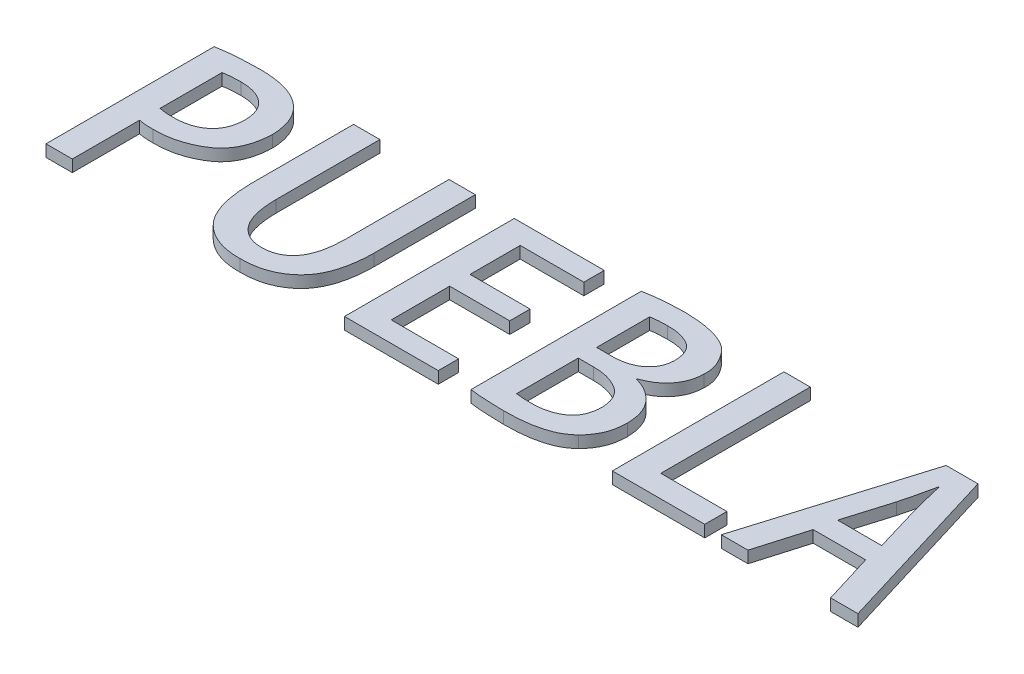
from build123d import *

# Parameters (mm, degrees)
SALIENTE_EXTRUIR1_DEPTH   = 0.3
SALIENTE_EXTRUIR1_2_DEPTH = 0.3
SALIENTE_EXTRUIR1_3_DEPTH = 0.3
SALIENTE_EXTRUIR1_4_DEPTH = 0.3
SALIENTE_EXTRUIR1_5_DEPTH = 0.3
SALIENTE_EXTRUIR1_6_DEPTH = 0.3


with BuildPart() as part:
    # Croquis1 → Saliente-Extruir1 (new body)
    with BuildSketch(Plane(origin=(0, 0, 0), x_dir=(1, 0, 0), z_dir=(0, 1, 0))):
        with BuildLine():
            Line((-10.215103216, -3.577941282), (-9.548221633, -3.577941282))
            Line((-9.548221633, -3.577941282), (-9.548221633, -1.875213278))
            add(Edge.make_bspline(
                [(-9.548221633, -1.875213278), (-9.520350913, -1.88015728), (-9.462938021, -1.890341783), (-9.373435224, -1.898640382), (-9.278633093, -1.903839455), (-9.213694309, -1.903745706), (-9.180287408, -1.903697479)],
                knots=[0, 0, 0, 0, 0.918571729, 1.892231672, 2.915686383, 4, 4, 4, 4], degree=3))
            add(Edge.make_bspline(
                [(-9.180287408, -1.903697479), (-9.129611086, -1.9036698), (-9.02944017, -1.903615088), (-8.881261609, -1.889723662), (-8.736809014, -1.867048802), (-8.596152434, -1.833407476), (-8.459358645, -1.788596242), (-8.326131654, -1.734489279), (-8.196758559, -1.670109055), (-8.072010865, -1.596305731), (-7.955554322, -1.509944508), (-7.852528436, -1.407990924), (-7.765248608, -1.291123391), (-7.692289474, -1.160444791), (-7.634194871, -1.016060674), (-7.590810943, -0.85763014), (-7.561903091, -0.685334874), (-7.555166904, -0.56539569), (-7.551685697, -0.503412094)],
                knots=[0, 0, 0, 0, 1.002223409, 1.981075816, 2.941057117, 3.893567037, 4.839120738, 5.786658294, 6.736252809, 7.695867274, 8.651375827, 9.597441389, 10.552949943, 11.527852714, 12.550822771, 13.624507394, 14.772364707, 16, 16, 16, 16], degree=3))
            add(Edge.make_bspline(
                [(-7.551685697, -0.503412094), (-7.553820832, -0.454883355), (-7.557988998, -0.360146555), (-7.578764184, -0.22263141), (-7.610733835, -0.093588342), (-7.654112582, 0.027315295), (-7.710313298, 0.139206348), (-7.777346298, 0.243071187), (-7.856167965, 0.338391658), (-7.917525413, 0.393601624), (-7.948364782, 0.421351157)],
                knots=[0, 0, 0, 0, 1.121960372, 2.190267843, 3.207584746, 4.190239261, 5.152208329, 6.094546313, 7.042284316, 8, 8, 8, 8], degree=3))
            add(Edge.make_bspline(
                [(-7.948364782, 0.421351157), (-7.983047776, 0.449337645), (-8.053504953, 0.506191127), (-8.173465029, 0.576538023), (-8.30520151, 0.636212701), (-8.449185823, 0.685810899), (-8.605979342, 0.723359079), (-8.775297849, 0.748515141), (-8.95681361, 0.765865816), (-9.081963044, 0.767228235), (-9.146614857, 0.767932056)],
                knots=[0, 0, 0, 0, 0.838628006, 1.70364077, 2.610636308, 3.559859354, 4.568055018, 5.643200099, 6.782484425, 8, 8, 8, 8], degree=3))
            add(Edge.make_bspline(
                [(-9.146614857, 0.767932056), (-9.201095723, 0.766953778), (-9.307335336, 0.765046102), (-9.462317186, 0.760318743), (-9.608818019, 0.753046696), (-9.74677935, 0.742957147), (-9.876361541, 0.731889146), (-9.997410579, 0.717902858), (-10.109697528, 0.70167953), (-10.181462099, 0.688734839), (-10.215923696, 0.682518754)],
                knots=[0, 0, 0, 0, 1.217605855, 2.374374404, 3.464660226, 4.494999595, 5.465333604, 6.370582827, 7.217548217, 8, 8, 8, 8], degree=3))
            Line((-10.215923696, 0.682518754), (-10.215103216, -3.577941282))
        make_face()
        with BuildLine():
            add(Edge.make_bspline(
                [(-9.548221633, 0.212546688), (-9.522541986, 0.217605893), (-9.464399067, 0.229060761), (-9.365001308, 0.239581334), (-9.243640978, 0.247627745), (-9.155117711, 0.250039934), (-9.107193333, 0.251345835)],
                knots=[0, 0, 0, 0, 0.7081459, 1.603358068, 2.702515415, 4, 4, 4, 4], degree=3))
            add(Edge.make_bspline(
                [(-9.107193333, 0.251345835), (-9.074597065, 0.250665074), (-9.010919284, 0.249335187), (-8.917805658, 0.240424923), (-8.829715919, 0.22474425), (-8.746508873, 0.203401444), (-8.668134692, 0.176711592), (-8.595132951, 0.142464591), (-8.527060134, 0.102499207), (-8.464384125, 0.056194149), (-8.407083461, 0.004666536), (-8.3577692, -0.054161378), (-8.315308541, -0.118814723), (-8.2809486, -0.189874601), (-8.2537786, -0.266740419), (-8.234165544, -0.349602283), (-8.221744084, -0.438439087), (-8.219644781, -0.499811722), (-8.218566478, -0.531335674)],
                knots=[0, 0, 0, 0, 1.16517395, 2.276202082, 3.339667925, 4.360262278, 5.344409501, 6.294443781, 7.237649562, 8.161467064, 9.075802852, 9.985465996, 10.897442204, 11.83402534, 12.799705885, 13.806079676, 14.873096483, 16, 16, 16, 16], degree=3))
            add(Edge.make_bspline(
                [(-8.218566478, -0.531335674), (-8.219668589, -0.56476907), (-8.22181711, -0.629946143), (-8.233962251, -0.724622728), (-8.25465111, -0.813129388), (-8.282603263, -0.89569976), (-8.317680611, -0.972665381), (-8.361753618, -1.043188549), (-8.413897457, -1.107414623), (-8.473181539, -1.166073002), (-8.539748123, -1.217720806), (-8.613054724, -1.262207725), (-8.691932445, -1.301168873), (-8.777655358, -1.332225993), (-8.869664708, -1.35562452), (-8.967514775, -1.374050666), (-9.07193087, -1.384453841), (-9.143581899, -1.386211064), (-9.180287408, -1.387111258)],
                knots=[0, 0, 0, 0, 1.098810706, 2.142087657, 3.130558938, 4.080710143, 5.002414742, 5.90351999, 6.805477983, 7.715119197, 8.638227497, 9.567016518, 10.528554789, 11.524610674, 12.556657526, 13.645294696, 14.7937276, 16, 16, 16, 16], degree=3))
            add(Edge.make_bspline(
                [(-9.180287408, -1.387111258), (-9.216161545, -1.387234798), (-9.284679018, -1.387470752), (-9.381990202, -1.38162005), (-9.469260651, -1.372005766), (-9.522850395, -1.359404555), (-9.548221633, -1.353438706)],
                knots=[0, 0, 0, 0, 1.161542367, 2.218477041, 3.156565424, 4, 4, 4, 4], degree=3))
            Line((-9.548221633, -1.353438706), (-9.548221633, 0.212546688))
        make_face(mode=Mode.SUBTRACT)
    extrude(amount=SALIENTE_EXTRUIR1_DEPTH)


with BuildPart() as body_2:
    # Croquis1 → Saliente-Extruir1 2 (new body)
    with BuildSketch(Plane(origin=(0, 0, 0), x_dir=(1, 0, 0), z_dir=(0, 1, 0))):
        with BuildLine():
            Line((-3.661274846, 0.744646633), (-4.32815643, 0.744646633))
            Line((-4.32815643, 0.744646633), (-4.32815643, -1.883706807))
            add(Edge.make_bspline(
                [(-4.32815643, -1.883706807), (-4.329655429, -1.935558276), (-4.332559144, -2.035999858), (-4.343561411, -2.181206874), (-4.362274872, -2.315668667), (-4.388295362, -2.439275598), (-4.421736178, -2.552320019), (-4.462608717, -2.654412765), (-4.510511118, -2.745968439), (-4.565435138, -2.826941756), (-4.627854346, -2.897196695), (-4.695244721, -2.958606014), (-4.76880987, -3.00970639), (-4.847946944, -3.05143435), (-4.932772322, -3.083141251), (-5.022992432, -3.106459931), (-5.118932888, -3.119567849), (-5.184712447, -3.120949978), (-5.218424243, -3.121658315)],
                knots=[0, 0, 0, 0, 1.438585386, 2.786686621, 4.036552978, 5.201082612, 6.286862056, 7.302011853, 8.246194207, 9.147550894, 10.00824043, 10.846879081, 11.670430889, 12.485539397, 13.321768657, 14.176240106, 15.065329361, 16, 16, 16, 16], degree=3))
            add(Edge.make_bspline(
                [(-5.218424243, -3.121658315), (-5.249679282, -3.121295871), (-5.310849122, -3.120586526), (-5.400216049, -3.107134353), (-5.484736532, -3.083917267), (-5.564867689, -3.051600867), (-5.640987235, -3.010849071), (-5.711164992, -2.958819618), (-5.777370385, -2.898429369), (-5.839131913, -2.828675921), (-5.894692447, -2.747984077), (-5.942716651, -2.656605797), (-5.984299517, -2.55437008), (-6.016951527, -2.441027624), (-6.044431961, -2.317116595), (-6.063543247, -2.182306163), (-6.076020104, -2.036700568), (-6.078068576, -1.936028404), (-6.079127518, -1.883986717)],
                knots=[0, 0, 0, 0, 0.880620858, 1.723480129, 2.540049658, 3.347149052, 4.155502796, 4.967718036, 5.803797264, 6.678919068, 7.589027408, 8.559476972, 9.584493291, 10.69587747, 11.881568968, 13.161133164, 14.532470029, 16, 16, 16, 16], degree=3))
            Line((-6.079127518, -1.883986717), (-6.079127518, 0.744646633))
            Line((-6.079127518, 0.744646633), (-6.746009102, 0.744646633))
            Line((-6.746009102, 0.744646633), (-6.746009102, -1.843969282))
            add(Edge.make_bspline(
                [(-6.746009102, -1.843969282), (-6.744320163, -1.921423283), (-6.74105939, -2.070960884), (-6.719359671, -2.286539978), (-6.686228752, -2.485366125), (-6.640690087, -2.66742907), (-6.582706007, -2.832726342), (-6.5119174, -2.981076339), (-6.428799591, -3.112975235), (-6.332822765, -3.228019066), (-6.225971478, -3.326755054), (-6.110917482, -3.412244231), (-5.986899263, -3.484091292), (-5.85403463, -3.542344372), (-5.712936211, -3.587901969), (-5.56311633, -3.618577115), (-5.405069403, -3.637331995), (-5.296773969, -3.637935872), (-5.241420132, -3.638244536)],
                knots=[0, 0, 0, 0, 1.38962604, 2.682900096, 3.883708864, 5.003577014, 6.046051179, 7.021519621, 7.946782916, 8.836077995, 9.701502405, 10.551298335, 11.403065278, 12.267387725, 13.149723428, 14.058184006, 15.007465389, 16, 16, 16, 16], degree=3))
            add(Edge.make_bspline(
                [(-5.241420132, -3.638244536), (-5.183600376, -3.637668213), (-5.070636242, -3.636542233), (-4.905757123, -3.616966204), (-4.749475123, -3.585305213), (-4.601955464, -3.539657541), (-4.463713887, -3.478600884), (-4.333236745, -3.406142648), (-4.212889994, -3.31768041), (-4.100008521, -3.217547068), (-3.998275414, -3.101071197), (-3.910116581, -2.967499268), (-3.835334395, -2.817648031), (-3.773804383, -2.651273132), (-3.725873808, -2.468545742), (-3.691237991, -2.26934804), (-3.667616862, -2.05399255), (-3.663977459, -1.904585031), (-3.662095326, -1.827318276)],
                knots=[0, 0, 0, 0, 1.011965347, 1.977106012, 2.902281606, 3.801441794, 4.675206323, 5.544580214, 6.409541179, 7.285433736, 8.18245704, 9.109221175, 10.080450816, 11.108962635, 12.210199246, 13.38382548, 14.647033859, 16, 16, 16, 16], degree=3))
            Line((-3.662095326, -1.827318276), (-3.661274846, 0.744646633))
        make_face()
    extrude(amount=SALIENTE_EXTRUIR1_2_DEPTH)


with BuildPart() as body_3:
    # Croquis1 → Saliente-Extruir1 3 (new body)
    with BuildSketch(Plane(origin=(0, 0, 0), x_dir=(1, 0, 0), z_dir=(0, 1, 0))):
        Polygon((-0.270575443, -3.06868484), (-1.979289019, -3.06868484), (-1.979289019, -1.58791625), (-0.45790949, -1.58791625), (-0.45790949, -1.071328425), (-1.979289019, -1.071328425), (-1.979289019, 0.199192037), (-0.367080861, 0.199192037), (-0.367080861, 0.715779863), (-2.646170603, 0.715779863), (-2.646170603, -3.585272665), (-0.270575443, -3.585272665), align=None)
    extrude(amount=SALIENTE_EXTRUIR1_3_DEPTH)


with BuildPart() as body_4:
    # Croquis1 → Saliente-Extruir1 4 (new body)
    with BuildSketch(Plane(origin=(0, 0, 0), x_dir=(1, 0, 0), z_dir=(0, 1, 0))):
        with BuildLine():
            add(Edge.make_bspline(
                [(2.427912571, -1.249105447), (2.457304513, -1.238302352), (2.51499113, -1.217099466), (2.596974007, -1.178937297), (2.674335394, -1.137753039), (2.74604166, -1.09221914), (2.812449258, -1.042157829), (2.874162796, -0.989170317), (2.930244684, -0.931460251), (2.980136332, -0.869884267), (3.024529145, -0.80542697), (3.06432428, -0.739163923), (3.097196457, -0.67007939), (3.123294998, -0.598671394), (3.145244396, -0.525633836), (3.159512944, -0.44991315), (3.168998425, -0.372246203), (3.170306483, -0.319747514), (3.170968839, -0.293163966)],
                knots=[0, 0, 0, 0, 1.158010079, 2.272789037, 3.3421568, 4.398545089, 5.411311129, 6.416452725, 7.404821061, 8.383909716, 9.344703944, 10.298264987, 11.240518476, 12.169838246, 13.108875005, 14.058285776, 15.016782025, 16, 16, 16, 16], degree=3))
            add(Edge.make_bspline(
                [(3.170968839, -0.293163966), (3.172279888, -0.263033669), (3.174920164, -0.202355281), (3.1648979, -0.111205119), (3.146460736, -0.019799734), (3.115096551, 0.070639332), (3.074763229, 0.16192161), (3.022727489, 0.252587232), (2.960430361, 0.343270192), (2.888837475, 0.43451757), (2.800622897, 0.521834376), (2.6891127, 0.596425571), (2.557141455, 0.659823121), (2.405275975, 0.714129553), (2.232137514, 0.755461388), (2.039154019, 0.789379123), (1.824753378, 0.810806275), (1.674911301, 0.817168057), (1.596571723, 0.820494088)],
                knots=[0, 0, 0, 0, 0.662582201, 1.334351894, 2.01115102, 2.710095991, 3.435323525, 4.2039863, 5.00579069, 5.854169704, 6.752811591, 7.723346771, 8.789937867, 9.967205469, 11.26427748, 12.700938597, 14.275203597, 16, 16, 16, 16], degree=3))
            add(Edge.make_bspline(
                [(1.596571723, 0.820494088), (1.498805662, 0.818967553), (1.307727032, 0.815984021), (1.0730719, 0.799095328), (0.896136507, 0.780236647), (0.774738941, 0.764928746), (0.663624979, 0.746859173), (0.59293774, 0.733314703), (0.559292872, 0.726867968)],
                knots=[0, 0, 0, 0, 1.687173059, 3.297491112, 4.057661749, 4.757936521, 5.408817464, 6, 6, 6, 6], degree=3))
            Line((0.559292872, 0.726867968), (0.560113352, -3.585595885))
            add(Edge.make_bspline(
                [(0.560113352, -3.585595885), (0.585547474, -3.589391121), (0.639571911, -3.597452556), (0.725952737, -3.605797876), (0.821729996, -3.61439701), (0.927225423, -3.620228237), (1.042143949, -3.62747002), (1.166755119, -3.631799366), (1.300610405, -3.636310643), (1.392889841, -3.637586096), (1.440528191, -3.638244536)],
                knots=[0, 0, 0, 0, 0.699185398, 1.485134748, 2.359315875, 3.314070099, 4.357999124, 5.490443077, 6.704465959, 8, 8, 8, 8], degree=3))
            add(Edge.make_bspline(
                [(1.440528191, -3.638244536), (1.48378965, -3.63831731), (1.568701305, -3.638460148), (1.693539879, -3.632776324), (1.813576544, -3.626130181), (1.928598488, -3.614407868), (2.038367936, -3.599511745), (2.143461599, -3.58267672), (2.243151078, -3.561264895), (2.33801951, -3.536750366), (2.427435692, -3.508503313), (2.512380306, -3.478870083), (2.591546737, -3.44368605), (2.666137843, -3.406403724), (2.735789358, -3.36523265), (2.799466933, -3.319766174), (2.859339319, -3.272430309), (2.895295218, -3.237497197), (2.913086369, -3.220212125)],
                knots=[0, 0, 0, 0, 1.322760237, 2.59625459, 3.820847638, 4.998735831, 6.130623795, 7.208270984, 8.252558636, 9.247527692, 10.203409462, 11.119645776, 11.996881918, 12.850511325, 13.668888328, 14.467895536, 15.241907374, 16, 16, 16, 16], degree=3))
            add(Edge.make_bspline(
                [(2.913086369, -3.220212125), (2.934033209, -3.200073636), (2.977990659, -3.157812528), (3.03861953, -3.083028981), (3.097299965, -2.995152432), (3.156484425, -2.895668763), (3.207947848, -2.78034156), (3.245368869, -2.647986901), (3.268775719, -2.499640909), (3.273582064, -2.395186479), (3.276092903, -2.34061937)],
                knots=[0, 0, 0, 0, 0.711698037, 1.493515599, 2.35333271, 3.30048251, 4.327872579, 5.4385067, 6.661873096, 8, 8, 8, 8], degree=3))
            add(Edge.make_bspline(
                [(3.276092903, -2.34061937), (3.274373239, -2.303358023), (3.271025285, -2.230815242), (3.258270066, -2.124921398), (3.236390449, -2.025448927), (3.209164698, -1.931020731), (3.17234641, -1.843191048), (3.130231119, -1.760200431), (3.078530193, -1.684609296), (3.021020206, -1.614560539), (2.957672357, -1.55098103), (2.891153842, -1.492680898), (2.821936669, -1.439665221), (2.749391173, -1.392831237), (2.673862187, -1.351337004), (2.594317222, -1.317318187), (2.512640376, -1.287015814), (2.456059678, -1.272723161), (2.427708855, -1.265561559)],
                knots=[0, 0, 0, 0, 1.205821652, 2.347570949, 3.442991661, 4.495930151, 5.519937987, 6.51755612, 7.49950264, 8.474121847, 9.444229276, 10.39759717, 11.33229336, 12.260302398, 13.187086564, 14.114546721, 15.055258179, 16, 16, 16, 16], degree=3))
            Line((2.427708855, -1.265561559), (2.427912571, -1.249105447))
        make_face()
        with BuildLine():
            Line((1.226994935, -1.070097304), (1.226994935, 0.269587272))
            add(Edge.make_bspline(
                [(1.226994935, 0.269587272), (1.237376504, 0.272086597), (1.259923636, 0.277514738), (1.297159993, 0.284210928), (1.340866843, 0.288454541), (1.390906942, 0.29376041), (1.447614778, 0.297578368), (1.51057095, 0.301145419), (1.579875371, 0.302215424), (1.628055607, 0.303326887), (1.653240164, 0.303907867)],
                knots=[0, 0, 0, 0, 0.598125682, 1.299034808, 2.116997753, 3.056965804, 4.117876534, 5.300287432, 6.588818354, 8, 8, 8, 8], degree=3))
            add(Edge.make_bspline(
                [(1.653240164, 0.303907867), (1.706982181, 0.303679804), (1.811774752, 0.303235101), (1.964389556, 0.278864514), (2.106876897, 0.235781986), (2.217933297, 0.185516288), (2.297923748, 0.132905898), (2.351257224, 0.08599044), (2.395997753, 0.029878324), (2.432980164, -0.033902468), (2.462499309, -0.105201379), (2.4848695, -0.183957294), (2.498353308, -0.270850896), (2.502125523, -0.331447095), (2.504088058, -0.362972915)],
                knots=[0, 0, 0, 0, 1.568793518, 3.05902002, 4.496583038, 5.910283965, 6.602575845, 7.288225433, 7.9766698, 8.690178237, 9.436053456, 10.226181897, 11.077152205, 12, 12, 12, 12], degree=3))
            add(Edge.make_bspline(
                [(2.504088058, -0.362972915), (2.502951902, -0.388481848), (2.500717372, -0.438651468), (2.488720885, -0.512009591), (2.471557869, -0.582152872), (2.444323347, -0.647568773), (2.411400987, -0.709502554), (2.371951833, -0.768257868), (2.324696439, -0.822730167), (2.27048762, -0.872572739), (2.210169996, -0.917821667), (2.144539642, -0.958443824), (2.07261382, -0.991786834), (1.995944089, -1.019693394), (1.913926944, -1.042384997), (1.826067217, -1.056946687), (1.733195926, -1.068485884), (1.669430901, -1.070094806), (1.636814529, -1.070917784)],
                knots=[0, 0, 0, 0, 0.975427607, 1.918419381, 2.837405929, 3.729535512, 4.619205739, 5.516233806, 6.429000407, 7.369665814, 8.326325266, 9.308245348, 10.314901143, 11.351316717, 12.425366266, 13.562823508, 14.753362722, 16, 16, 16, 16], degree=3))
            Line((1.636814529, -1.070917784), (1.226994935, -1.070097304))
        make_face(mode=Mode.SUBTRACT)
        with BuildLine():
            Line((1.226994935, -1.536585339), (1.614378459, -1.536585339))
            add(Edge.make_bspline(
                [(1.614378459, -1.536585339), (1.646229576, -1.537097596), (1.709383706, -1.538113297), (1.802871038, -1.545017484), (1.893223241, -1.559608994), (1.9808127, -1.577733863), (2.06466495, -1.604072937), (2.146439946, -1.633709827), (2.224527191, -1.671475045), (2.299862199, -1.713066864), (2.369256135, -1.762322251), (2.430943419, -1.819230305), (2.482777032, -1.88503809), (2.526740215, -1.957717312), (2.561451245, -2.038408517), (2.586605453, -2.126753546), (2.60304495, -2.222621494), (2.607113511, -2.289088179), (2.609212122, -2.323372454)],
                knots=[0, 0, 0, 0, 1.068740361, 2.119089545, 3.141435227, 4.137701909, 5.116886027, 6.087633407, 7.053152307, 8.023812777, 8.971962115, 9.901283631, 10.829378799, 11.772934645, 12.743812377, 13.767024156, 14.848205587, 16, 16, 16, 16], degree=3))
            add(Edge.make_bspline(
                [(2.609212122, -2.323372454), (2.60741895, -2.357930645), (2.603957175, -2.424646337), (2.587970734, -2.520905139), (2.564597529, -2.609685608), (2.532562462, -2.691323146), (2.491079817, -2.764868602), (2.441749423, -2.831224374), (2.383107825, -2.889521112), (2.316734265, -2.939966612), (2.243993024, -2.983104974), (2.167421985, -3.021107094), (2.086622997, -3.053089635), (2.002134096, -3.079473544), (1.913355202, -3.09915661), (1.820859922, -3.112784953), (1.724313931, -3.121533842), (1.658734723, -3.121616297), (1.625316584, -3.121658315)],
                knots=[0, 0, 0, 0, 1.156628522, 2.232908233, 3.256814316, 4.22257225, 5.157273822, 6.072900156, 6.979323982, 7.913307726, 8.853910476, 9.803914165, 10.7696721, 11.757233573, 12.761296236, 13.807597155, 14.882785779, 16, 16, 16, 16], degree=3))
            add(Edge.make_bspline(
                [(1.625316584, -3.121658315), (1.585068104, -3.121666531), (1.509473827, -3.121681963), (1.402927686, -3.117494454), (1.310198501, -3.110910647), (1.253241034, -3.102526059), (1.226994935, -3.098662426)],
                knots=[0, 0, 0, 0, 1.209072829, 2.270868051, 3.203213042, 4, 4, 4, 4], degree=3))
            Line((1.226994935, -3.098662426), (1.226994935, -1.536585339))
        make_face(mode=Mode.SUBTRACT)
    extrude(amount=SALIENTE_EXTRUIR1_4_DEPTH)


with BuildPart() as body_5:
    # Croquis1 → Saliente-Extruir1 5 (new body)
    with BuildSketch(Plane(origin=(0, 0, 0), x_dir=(1, 0, 0), z_dir=(0, 1, 0))):
        Polygon((6.475865954, -3.019819378), (4.801213114, -3.019819378), (4.801213114, 0.766599077), (4.134331531, 0.766599077), (4.134331531, -3.581576096), (6.475865954, -3.581576096), align=None)
    extrude(amount=SALIENTE_EXTRUIR1_5_DEPTH)


with BuildPart() as body_6:
    # Croquis1 → Saliente-Extruir1 6 (new body)
    with BuildSketch(Plane(origin=(0, 0, 0), x_dir=(1, 0, 0), z_dir=(0, 1, 0))):
        Polygon((9.049534381, 0.76760643), (8.243544191, 0.76760643), (6.915191538, -3.601062288), (7.590805657, -3.601062288), (7.965420815, -2.323784699), (9.293601833, -2.323784699), (9.685244954, -3.601062288), (10.377715399, -3.601062288), align=None)
        with BuildLine():
            Line((8.067588586, -1.807196873), (8.413823809, -0.657779378))
            add(Edge.make_bspline(
                [(8.413823809, -0.657779378), (8.432341677, -0.588076481), (8.47014402, -0.44578511), (8.520020701, -0.229235739), (8.569357347, -0.013131742), (8.601842169, 0.129793248), (8.617709409, 0.199605084)],
                knots=[0, 0, 0, 0, 0.981880665, 2.004409445, 3.025252049, 4, 4, 4, 4], degree=3))
            Line((8.617709409, 0.199605084), (8.629511324, 0.199927502))
            add(Edge.make_bspline(
                [(8.629511324, 0.199927502), (8.645427081, 0.130526959), (8.678025463, -0.011618046), (8.730120399, -0.226936201), (8.785286969, -0.445521535), (8.824735663, -0.591070867), (8.844383172, -0.663562036)],
                knots=[0, 0, 0, 0, 0.960134074, 1.966530216, 2.987225846, 4, 4, 4, 4], degree=3))
            Line((8.844383172, -0.663562036), (9.185758075, -1.807196873))
            Line((9.185758075, -1.807196873), (8.067588586, -1.807196873))
        make_face(mode=Mode.SUBTRACT)
    extrude(amount=SALIENTE_EXTRUIR1_6_DEPTH)


solid = Compound([part.part, body_2.part, body_3.part, body_4.part, body_5.part, body_6.part])
